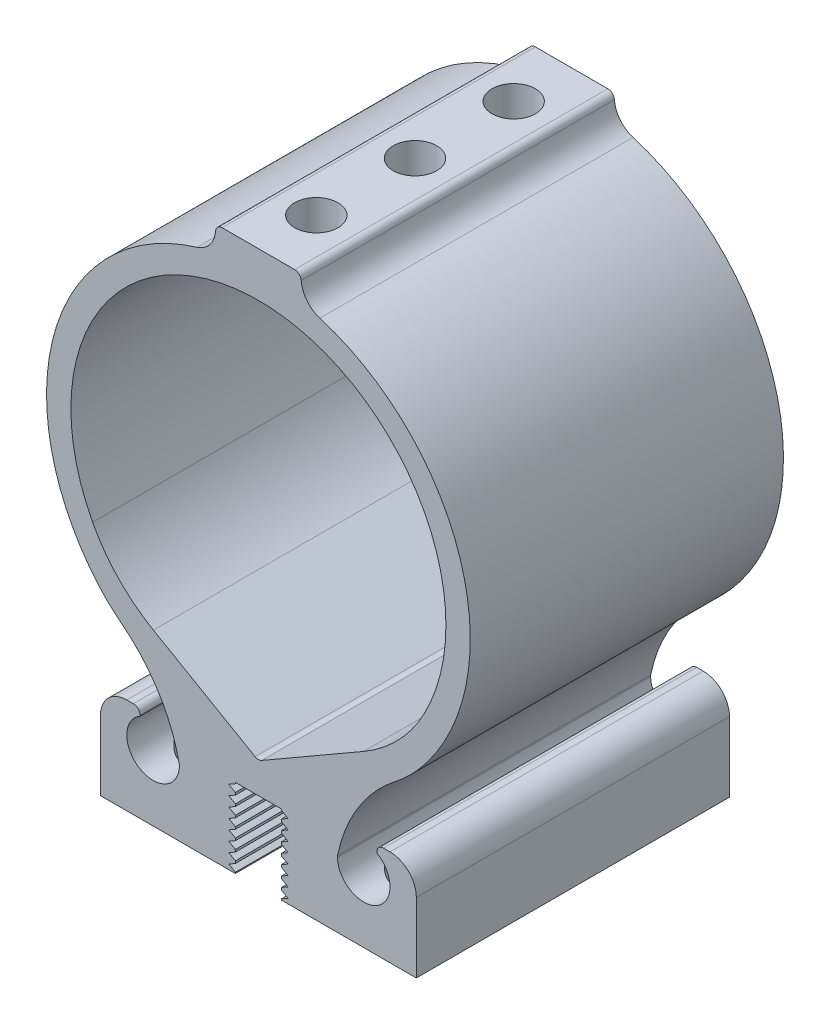
from build123d import *

# Parameters (mm, degrees)
BOSS_EXTRU_1_DEPTH         = 11.9
ESQUISSE2_W                = 3.5
ESQUISSE2_H                = 6
ENL_V_MAT_EXTRU_1_DEPTH    = 51.888603832
CONG_1_R                   = 2
CONG_2_R                   = 12
CONG_3_R                   = 0.5
TROU_TARAUD_M41_REACH      = 48.528
TROU_TARAUD_M41_BORE_R     = 1.65
TROU_TARAUD_M42_REACH      = 48.528
TROU_TARAUD_M42_BORE_R     = 1.65
ENL_V_MAT_EXTRU_2_DEPTH    = 51.888603993
R_P_TITION_LIN_AIRE1_COUNT = 8
R_P_TITION_LIN_AIRE1_PITCH = 0.75
SYM_TRIE1_COPY_1_DEPTH     = 51.888603993
SYM_TRIE1_COPY_2_DEPTH     = 51.888603993
SYM_TRIE1_COPY_3_DEPTH     = 51.888603993
SYM_TRIE1_COPY_4_DEPTH     = 51.888603993
SYM_TRIE1_COPY_5_DEPTH     = 51.888603993
SYM_TRIE1_COPY_6_DEPTH     = 51.888603993
SYM_TRIE1_COPY_7_DEPTH     = 51.888603993


with BuildPart() as part:
    # Esquisse1 → Boss.-Extru.1 (new, symmetric)
    with BuildSketch(Plane.XY):
        with BuildLine():
            Line((-12, 0), (12, 0))
            Line((12, 0), (12, 7.3))
            Line((12, 7.3), (9, 7.3))
            Line((9, 7.3), (9, 6.732050808))
            ThreePointArc((9, 6.732050808), (9, 3.267949192), (6, 5))
            ThreePointArc((6, 5), (7.723383446, 9.224285716), (10.898967841, 12.5))
            ThreePointArc((10.898967841, 12.5), (15.51594482, 28.647145138), (3.25, 40.118560492))
            Line((3.25, 40.118560492), (3.25, 42))
            Line((3.25, 42), (-3.25, 42))
            Line((-3.25, 42), (-3.25, 40.118560492))
            ThreePointArc((-3.25, 40.118560492), (-15.51594482, 28.647145138), (-10.898967841, 12.5))
            ThreePointArc((-10.898967841, 12.5), (-7.723383446, 9.224285716), (-6, 5))
            ThreePointArc((-6, 5), (-9, 3.267949192), (-9, 6.732050808))
            Line((-9, 6.732050808), (-9, 7.3))
            Line((-9, 7.3), (-12, 7.3))
            Line((-12, 7.3), (-12, 0))
        make_face()
        with BuildLine():
            Line((0, 8.3), (-9.646601971, 13.861645963))
            ThreePointArc((-9.646601971, 13.861645963), (0, 38.6), (9.646601971, 13.861645963))
            Line((9.646601971, 13.861645963), (0, 8.3))
        make_face(mode=Mode.SUBTRACT)
    extrude(amount=BOSS_EXTRU_1_DEPTH, both=True)

    # Esquisse2 → Enlèv. mat.-Extru.1 (cut, through all)
    with BuildSketch(Plane.XY.offset(11.9)):
        with Locations((0, 3)):
            Rectangle(ESQUISSE2_W, ESQUISSE2_H)
    extrude(amount=-ENL_V_MAT_EXTRU_1_DEPTH, mode=Mode.SUBTRACT)

    # Congé1
    cong_1_edges = [part.edges().sort_by_distance(p)[0] for p in [
        (-12, 7.3, 0),
        (-3.25, 40.118560492, 0),
        (3.25, 40.118560492, 0),
        (12, 7.3, 0),
    ]]
    fillet(cong_1_edges, radius=CONG_1_R)

    # Congé2
    cong_2_edges = [part.edges().sort_by_distance(p)[0] for p in [
        (-10.898967841, 12.5, 0),
        (10.898967841, 12.5, 0),
        (9.646601971, 13.861645963, 0),
        (-9.646601971, 13.861645963, 0),
    ]]
    fillet(cong_2_edges, radius=CONG_2_R)

    # Congé3
    cong_3_edges = [part.edges().sort_by_distance(p)[0] for p in [
        (3.25, 42, 0),
        (-3.25, 42, 0),
        (-6, 5, 0),
        (-9, 7.3, 0),
        (9, 7.3, 0),
        (6, 5, 0),
        (0, 8.3, 0),
    ]]
    fillet(cong_3_edges, radius=CONG_3_R)

    # Trou taraudé M41 bore → Trou taraudé M41 (cut, up to next)
    with BuildSketch(Plane(origin=(0, 42, 0), x_dir=(1, 0, 0), z_dir=(0, 1, 0)), mode=Mode.PRIVATE) as trou_taraud_m41_sk1:
        Circle(TROU_TARAUD_M41_BORE_R)
    trou_taraud_m41_tool1 = extrude(trou_taraud_m41_sk1.sketch, amount=-TROU_TARAUD_M41_REACH, mode=Mode.PRIVATE) & part.part
    # Trou taraudé M41 bore → Trou taraudé M41 (cut, up to next)
    with BuildSketch(Plane(origin=(0, 42, 0), x_dir=(1, 0, 0), z_dir=(0, 1, 0)), mode=Mode.PRIVATE) as trou_taraud_m41_sk2:
        with Locations((0, 7.5)):
            Circle(TROU_TARAUD_M41_BORE_R)
    trou_taraud_m41_tool2 = extrude(trou_taraud_m41_sk2.sketch, amount=-TROU_TARAUD_M41_REACH, mode=Mode.PRIVATE) & part.part
    # Trou taraudé M41 bore → Trou taraudé M41 (cut, up to next)
    with BuildSketch(Plane(origin=(0, 42, 0), x_dir=(1, 0, 0), z_dir=(0, 1, 0)), mode=Mode.PRIVATE) as trou_taraud_m41_sk3:
        with Locations((0, -7.5)):
            Circle(TROU_TARAUD_M41_BORE_R)
    trou_taraud_m41_tool3 = extrude(trou_taraud_m41_sk3.sketch, amount=-TROU_TARAUD_M41_REACH, mode=Mode.PRIVATE) & part.part
    add(trou_taraud_m41_tool1.solids().sort_by_distance((0, 42, 0))[0], mode=Mode.SUBTRACT)
    add(trou_taraud_m41_tool2.solids().sort_by_distance((0, 42, -7.5))[0], mode=Mode.SUBTRACT)
    add(trou_taraud_m41_tool3.solids().sort_by_distance((0, 42, 7.5))[0], mode=Mode.SUBTRACT)

    # Trou taraudé M42 bore → Trou taraudé M42 (cut, up to next)
    with BuildSketch(Plane(origin=(0, 0, 0), x_dir=(-1, 0, 0), z_dir=(0, -1, 0)), mode=Mode.PRIVATE) as trou_taraud_m42_sk1:
        with Locations((8, -8)):
            Circle(TROU_TARAUD_M42_BORE_R)
    trou_taraud_m42_tool1 = extrude(trou_taraud_m42_sk1.sketch, amount=-TROU_TARAUD_M42_REACH, mode=Mode.PRIVATE) & part.part
    # Trou taraudé M42 bore → Trou taraudé M42 (cut, up to next)
    with BuildSketch(Plane(origin=(0, 0, 0), x_dir=(-1, 0, 0), z_dir=(0, -1, 0)), mode=Mode.PRIVATE) as trou_taraud_m42_sk2:
        with Locations((8, 8)):
            Circle(TROU_TARAUD_M42_BORE_R)
    trou_taraud_m42_tool2 = extrude(trou_taraud_m42_sk2.sketch, amount=-TROU_TARAUD_M42_REACH, mode=Mode.PRIVATE) & part.part
    # Trou taraudé M42 bore → Trou taraudé M42 (cut, up to next)
    with BuildSketch(Plane(origin=(0, 0, 0), x_dir=(-1, 0, 0), z_dir=(0, -1, 0)), mode=Mode.PRIVATE) as trou_taraud_m42_sk3:
        with Locations((-8, 8)):
            Circle(TROU_TARAUD_M42_BORE_R)
    trou_taraud_m42_tool3 = extrude(trou_taraud_m42_sk3.sketch, amount=-TROU_TARAUD_M42_REACH, mode=Mode.PRIVATE) & part.part
    # Trou taraudé M42 bore → Trou taraudé M42 (cut, up to next)
    with BuildSketch(Plane(origin=(0, 0, 0), x_dir=(-1, 0, 0), z_dir=(0, -1, 0)), mode=Mode.PRIVATE) as trou_taraud_m42_sk4:
        with Locations((-8, -8)):
            Circle(TROU_TARAUD_M42_BORE_R)
    trou_taraud_m42_tool4 = extrude(trou_taraud_m42_sk4.sketch, amount=-TROU_TARAUD_M42_REACH, mode=Mode.PRIVATE) & part.part
    add(trou_taraud_m42_tool1.solids().sort_by_distance((-8, 0, 8))[0], mode=Mode.SUBTRACT)
    add(trou_taraud_m42_tool2.solids().sort_by_distance((-8, 0, -8))[0], mode=Mode.SUBTRACT)
    add(trou_taraud_m42_tool3.solids().sort_by_distance((8, 0, -8))[0], mode=Mode.SUBTRACT)
    add(trou_taraud_m42_tool4.solids().sort_by_distance((8, 0, 8))[0], mode=Mode.SUBTRACT)

    # Esquisse8 → Enlèv. mat.-Extru.2 (cut, through all)
    with BuildSketch(Plane.XY.offset(11.9)):
        Polygon((-1.75, 0.662350269), (-2.25, 0.373675135), (-1.75, 0.085), align=None)
    enl_v_mat_extru_2 = extrude(amount=-ENL_V_MAT_EXTRU_2_DEPTH, mode=Mode.SUBTRACT)

    # Répétition linéaire1: Enlèv. mat.-Extru.2 ×8
    with Locations(*[(0, i * R_P_TITION_LIN_AIRE1_PITCH, 0) for i in range(1, R_P_TITION_LIN_AIRE1_COUNT)]):
        add(enl_v_mat_extru_2, mode=Mode.SUBTRACT)

    # Symétrie1: Enlèv. mat.-Extru.2 across plane
    add(enl_v_mat_extru_2.mirror(Plane(origin=(0, 0, 0), x_dir=(0, 0, 1), z_dir=(1, 0, 0))), mode=Mode.SUBTRACT)

    # Symétrie1 copy 1 sketch → Symétrie1 copy 1 (cut, through all)
    with BuildSketch(Plane(origin=(0, 0.75, 11.9), x_dir=(-1, 0, 0), z_dir=(0, 0, 1))):
        Polygon((-1.75, -0.662350269), (-2.25, -0.373675135), (-1.75, -0.085), align=None)
    extrude(amount=-SYM_TRIE1_COPY_1_DEPTH, mode=Mode.SUBTRACT)

    # Symétrie1 copy 2 sketch → Symétrie1 copy 2 (cut, through all)
    with BuildSketch(Plane(origin=(0, 1.5, 11.9), x_dir=(-1, 0, 0), z_dir=(0, 0, 1))):
        Polygon((-1.75, -0.662350269), (-2.25, -0.373675135), (-1.75, -0.085), align=None)
    extrude(amount=-SYM_TRIE1_COPY_2_DEPTH, mode=Mode.SUBTRACT)

    # Symétrie1 copy 3 sketch → Symétrie1 copy 3 (cut, through all)
    with BuildSketch(Plane(origin=(0, 2.25, 11.9), x_dir=(-1, 0, 0), z_dir=(0, 0, 1))):
        Polygon((-1.75, -0.662350269), (-2.25, -0.373675135), (-1.75, -0.085), align=None)
    extrude(amount=-SYM_TRIE1_COPY_3_DEPTH, mode=Mode.SUBTRACT)

    # Symétrie1 copy 4 sketch → Symétrie1 copy 4 (cut, through all)
    with BuildSketch(Plane(origin=(0, 3, 11.9), x_dir=(-1, 0, 0), z_dir=(0, 0, 1))):
        Polygon((-1.75, -0.662350269), (-2.25, -0.373675135), (-1.75, -0.085), align=None)
    extrude(amount=-SYM_TRIE1_COPY_4_DEPTH, mode=Mode.SUBTRACT)

    # Symétrie1 copy 5 sketch → Symétrie1 copy 5 (cut, through all)
    with BuildSketch(Plane(origin=(0, 3.75, 11.9), x_dir=(-1, 0, 0), z_dir=(0, 0, 1))):
        Polygon((-1.75, -0.662350269), (-2.25, -0.373675135), (-1.75, -0.085), align=None)
    extrude(amount=-SYM_TRIE1_COPY_5_DEPTH, mode=Mode.SUBTRACT)

    # Symétrie1 copy 6 sketch → Symétrie1 copy 6 (cut, through all)
    with BuildSketch(Plane(origin=(0, 4.5, 11.9), x_dir=(-1, 0, 0), z_dir=(0, 0, 1))):
        Polygon((-1.75, -0.662350269), (-2.25, -0.373675135), (-1.75, -0.085), align=None)
    extrude(amount=-SYM_TRIE1_COPY_6_DEPTH, mode=Mode.SUBTRACT)

    # Symétrie1 copy 7 sketch → Symétrie1 copy 7 (cut, through all)
    with BuildSketch(Plane(origin=(0, 5.25, 11.9), x_dir=(-1, 0, 0), z_dir=(0, 0, 1))):
        Polygon((-1.75, -0.662350269), (-2.25, -0.373675135), (-1.75, -0.085), align=None)
    extrude(amount=-SYM_TRIE1_COPY_7_DEPTH, mode=Mode.SUBTRACT)


solid = part.part
